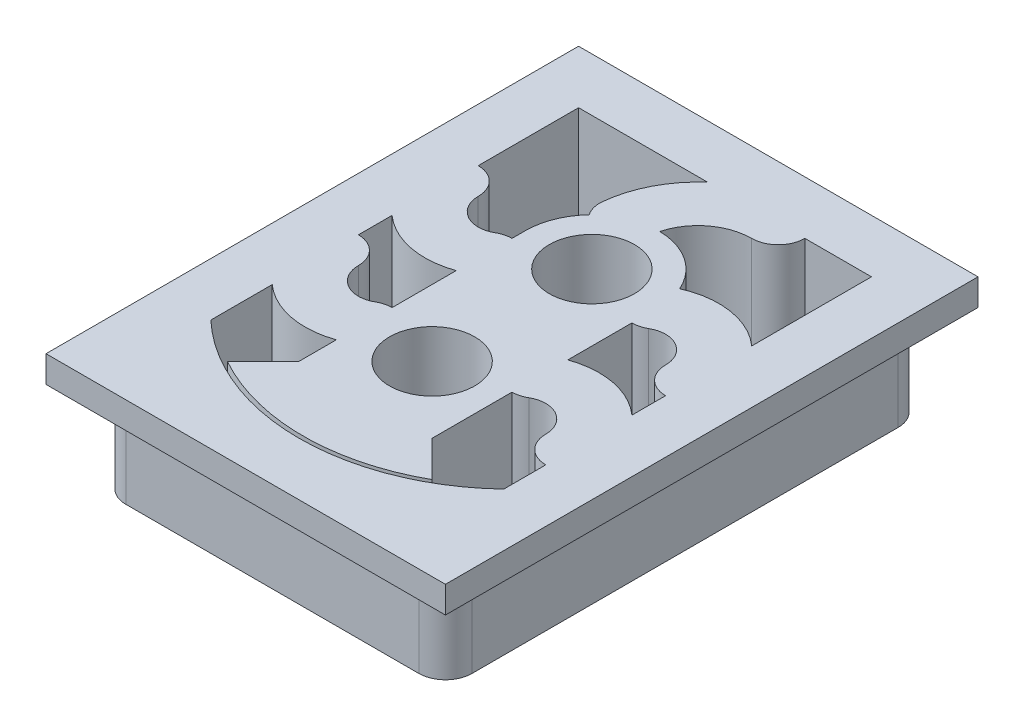
from build123d import *

# Parameters (mm, degrees)
SKETCH1_W           = 13
SKETCH1_H           = 18
BOSS_EXTRUDE1_DEPTH = 3.4
SKETCH2_W           = 15
SKETCH2_H           = 20
BOSS_EXTRUDE2_DEPTH = 1
SKETCH4_R           = 1.6
CUT_EXTRUDE2_DEPTH  = 14.251792332
FILLET1_R           = 1


with BuildPart() as part:
    # Sketch1 → Boss-Extrude1 (new body)
    with BuildSketch(Plane(origin=(0, 0, 0), x_dir=(1, 0, 0), z_dir=(0, 1, 0))):
        Rectangle(SKETCH1_W, SKETCH1_H)
    extrude(amount=BOSS_EXTRUDE1_DEPTH)

    # Sketch2 → Boss-Extrude2 (add)
    with BuildSketch(Plane(origin=(0, 3.4, 0), x_dir=(1, 0, 0), z_dir=(0, 1, 0))):
        Rectangle(SKETCH2_W, SKETCH2_H)
    extrude(amount=BOSS_EXTRUDE2_DEPTH)

    # Sketch4 → Cut-Extrude2 (cut, through all)
    with BuildSketch(Plane.XZ):
        with BuildLine():
            Line((-2.5, 5.5), (-3.844272635, 6.844272635))
            ThreePointArc((-3.844272635, 6.844272635), (0, 7.85), (3.844272635, 6.844272635))
            Line((3.844272635, 6.844272635), (2.5, 5.5))
            Line((2.5, 5.5), (2.5, 2.5))
            ThreePointArc((2.5, 2.5), (2.758819045, 2.465925826), (3, 2.366025404))
            ThreePointArc((3, 2.366025404), (4, 2.366025404), (4.5, 3.232050808))
            ThreePointArc((4.5, 3.232050808), (4.792893219, 3.939157589), (5.5, 4.232050808))
            Line((5.5, 4.232050808), (5.5, 5.809475019))
            ThreePointArc((5.5, 5.809475019), (0, 8), (-5.5, 5.809475019))
            Line((-5.5, 5.809475019), (-5.5, 3.50401717))
            ThreePointArc((-5.5, 3.50401717), (-4.08113883, 4.211123951), (-2.5, 4.096376317))
            Line((-2.5, 4.096376317), (-2.5, 5.5))
        make_face()
        with BuildLine():
            Line((-2.5, -0.403623683), (-2.5, 2))
            ThreePointArc((-2.5, 2), (-2.758819045, 2.034074174), (-3, 2.133974596))
            ThreePointArc((-3, 2.133974596), (-4, 2.133974596), (-4.5, 1.267949192))
            ThreePointArc((-4.5, 1.267949192), (-4.792893219, 0.560842411), (-5.5, 0.267949192))
            Line((-5.5, 0.267949192), (-5.5, -0.99598283))
            ThreePointArc((-5.5, -0.99598283), (-4.08113883, -0.288876049), (-2.5, -0.403623683))
        make_face()
        with Locations(Location((0, 3, 0), (0, 0, 270))):
            Circle(SKETCH4_R)
        with BuildLine():
            ThreePointArc((5.5, 0.99598283), (4.08113883, 0.288876049), (2.5, 0.403623683))
            Line((2.5, 0.403623683), (2.5, -2))
            ThreePointArc((2.5, -2), (2.758819045, -2.034074174), (3, -2.133974596))
            ThreePointArc((3, -2.133974596), (4, -2.133974596), (4.5, -1.267949192))
            ThreePointArc((4.5, -1.267949192), (4.792893219, -0.560842411), (5.5, -0.267949192))
            Line((5.5, -0.267949192), (5.5, 0.99598283))
        make_face()
        with BuildLine():
            Line((-2.5, -3), (-2.5, -2.5))
            ThreePointArc((-2.5, -2.5), (-2.758819045, -2.465925826), (-3, -2.366025404))
            ThreePointArc((-3, -2.366025404), (-4, -2.366025404), (-4.5, -3.232050808))
            ThreePointArc((-4.5, -3.232050808), (-4.792893219, -3.939157589), (-5.5, -4.232050808))
            Line((-5.5, -4.232050808), (-5.5, -8))
            Line((-5.5, -8), (-0.651664446, -8))
            ThreePointArc((-0.651664446, -8), (-1.569721359, -6.823531152), (-1.994806392, -5.393073127))
            ThreePointArc((-1.994806392, -5.393073127), (-1.967548056, -5.03860077), (-1.817997773, -4.716066461))
            ThreePointArc((-1.817997773, -4.716066461), (-2.323251432, -3.923310773), (-2.5, -3))
        make_face()
        with BuildLine():
            ThreePointArc((5.5, -3.50401717), (3.967891244, -4.231237532), (2.286254496, -4.011454587))
            ThreePointArc((2.286254496, -4.011454587), (1.385482489, -5.080970512), (0.051275139, -5.499474117))
            ThreePointArc((0.051275139, -5.499474117), (0.77025343, -6.581403062), (2, -7))
            ThreePointArc((2, -7), (2.707106781, -7.292893219), (3, -8))
            Line((3, -8), (5.5, -8))
            Line((5.5, -8), (5.5, -3.50401717))
        make_face()
        with Locations(Location((0, -3, 0), (0, 0, 270))):
            Circle(SKETCH4_R)
    extrude(amount=-CUT_EXTRUDE2_DEPTH, mode=Mode.SUBTRACT)

    # Fillet1
    fillet1_edges = [part.edges().sort_by_distance(p)[0] for p in [
        (6.5, 1.7, 9),
        (-6.5, 1.7, 9),
        (-6.5, 1.7, -9),
        (6.5, 1.7, -9),
    ]]
    fillet(fillet1_edges, radius=FILLET1_R)


solid = part.part
